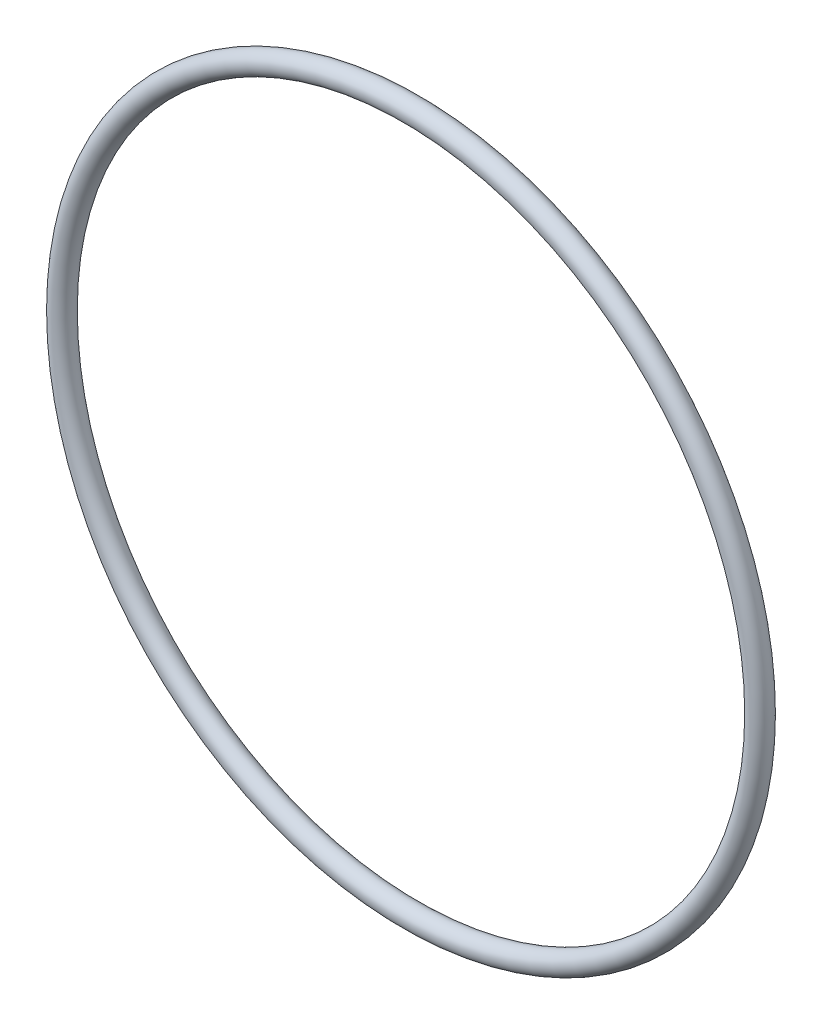
from build123d import *

# Parameters (mm, degrees)
SKETCH2_R = 0.9


with BuildPart() as part:
    # Sweep1: sweep along a path in Sketch1
    with BuildLine(Plane.XY) as sweep1_path:
        CenterArc((0, 0), 28, 0, 360)
    # Sketch2 → Sweep1 (sweep)
    with BuildSketch(Plane(origin=(0, 0, 0), x_dir=(1, 0, 0), z_dir=(0, 1, 0))):
        with Locations((-28.9, 0)):
            Circle(SKETCH2_R)
    sweep(path=sweep1_path.line)


solid = part.part
